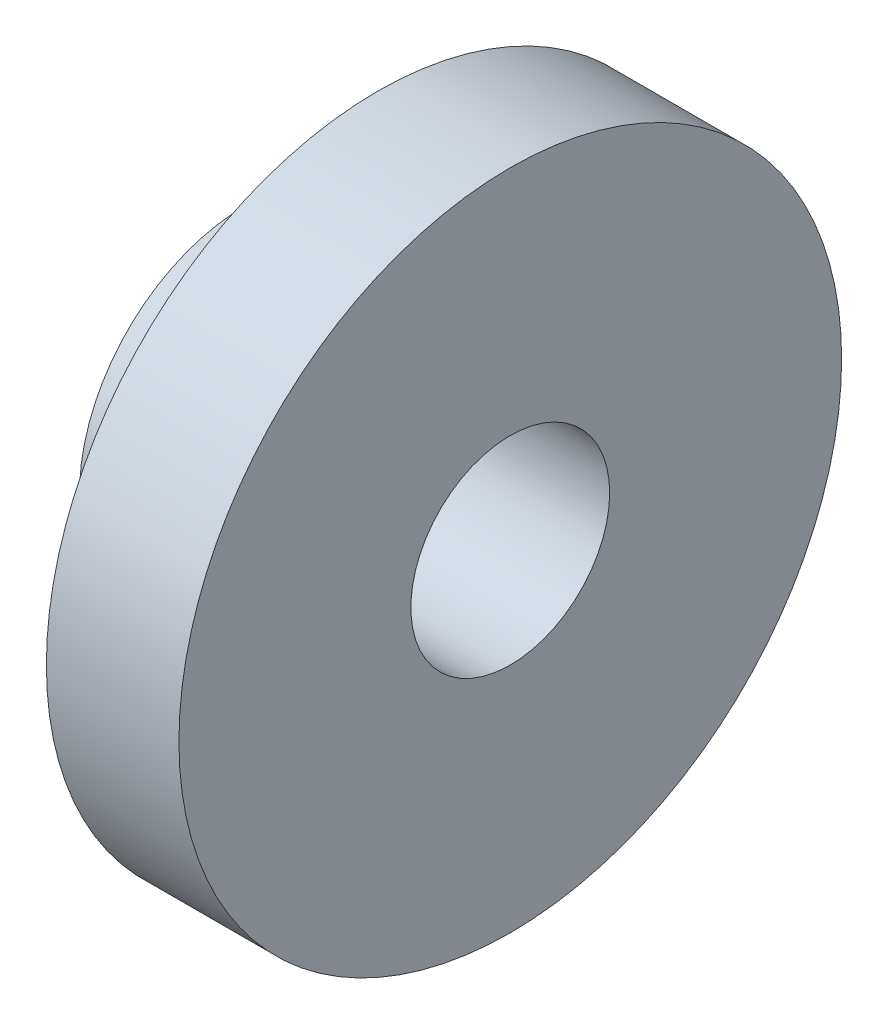
from build123d import *

# Parameters (mm, degrees)
SKETCH1_R           = 2.5
SKETCH1_R_2         = 1.5
BOSS_EXTRUDE1_DEPTH = 2
SKETCH2_R           = 5
SKETCH2_R_2         = 1.5
BOSS_EXTRUDE2_DEPTH = 2


with BuildPart() as part:
    # Sketch1 → Boss-Extrude1 (new body)
    with BuildSketch(Plane(origin=(0, 0, 0), x_dir=(0, 0, -1), z_dir=(1, 0, 0))):
        Circle(SKETCH1_R)
        Circle(SKETCH1_R_2, mode=Mode.SUBTRACT)
    extrude(amount=BOSS_EXTRUDE1_DEPTH)

    # Sketch2 → Boss-Extrude2 (add)
    with BuildSketch(Plane(origin=(2, 0, 0), x_dir=(0, 0, -1), z_dir=(1, 0, 0))):
        Circle(SKETCH2_R)
        Circle(SKETCH2_R_2, mode=Mode.SUBTRACT)
    extrude(amount=BOSS_EXTRUDE2_DEPTH)


solid = part.part
